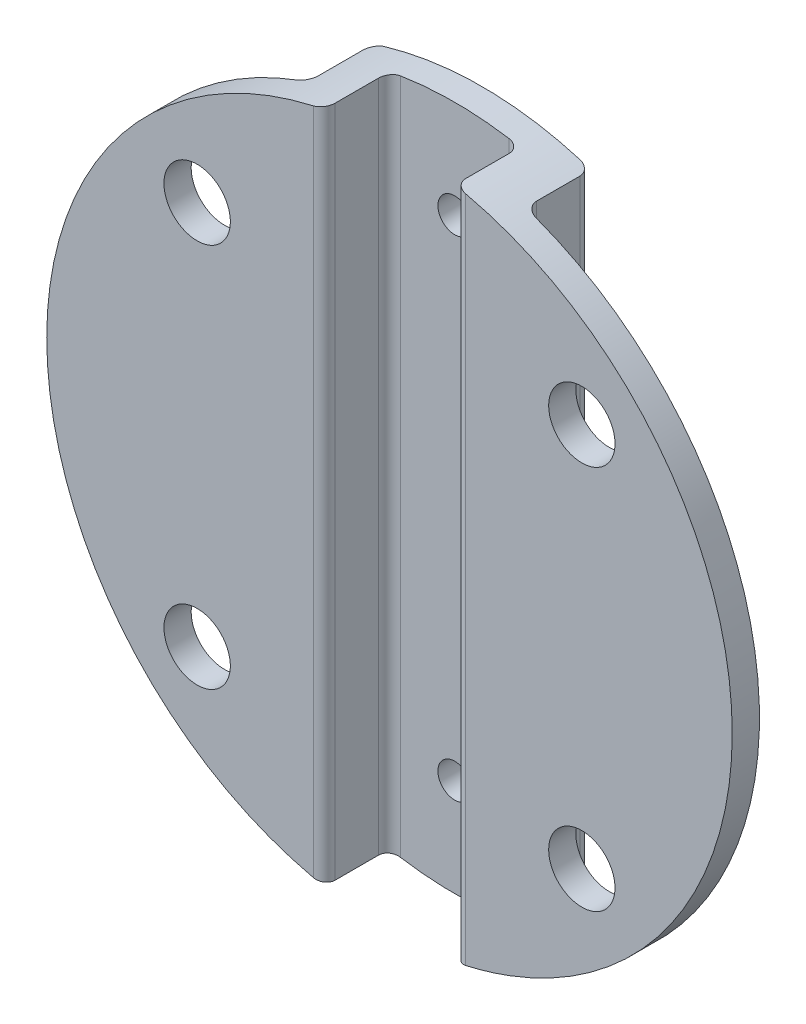
from build123d import *

# Parameters (mm, degrees)
EXTRUDE_1_DEPTH     = 64
SKETCH_2_W          = 73.114285432
SKETCH_2_H          = 69.176673978
SKETCH_2_R          = 31.5
CUT_EXTRUDE_2_DEPTH = 64
SKETCH_3_R          = 3.05
CUT_EXTRUDE_3_DEPTH = 64
SKETCH_4_R          = 1.55
CUT_EXTRUDE_4_DEPTH = 64


with BuildPart() as part:
    # 草图1 → 凸台-拉伸1 (new body)
    with BuildSketch(Plane(origin=(0, 0, 0), x_dir=(1, 0, 0), z_dir=(0, 1, 0))):
        with BuildLine():
            Line((-32, 0), (-7, 0))
            ThreePointArc((-7, 0), (-6.292893219, 0.292893219), (-6, 1))
            Line((-6, 1), (-6, 5))
            ThreePointArc((-6, 5), (-5.707106781, 5.707106781), (-5, 6))
            Line((-5, 6), (5, 6))
            ThreePointArc((5, 6), (5.707106781, 5.707106781), (6, 5))
            Line((6, 5), (6, 1))
            ThreePointArc((6, 1), (6.292893219, 0.292893219), (7, 0))
            Line((7, 0), (32, 0))
            Line((32, 0), (32, 2.5))
            Line((32, 2.5), (11, 2.5))
            ThreePointArc((11, 2.5), (10.292893219, 2.792893219), (10, 3.5))
            Line((10, 3.5), (10, 7.5))
            ThreePointArc((10, 7.5), (9.707106781, 8.207106781), (9, 8.5))
            Line((9, 8.5), (-9, 8.5))
            ThreePointArc((-9, 8.5), (-9.707106781, 8.207106781), (-10, 7.5))
            Line((-10, 7.5), (-10, 3.5))
            ThreePointArc((-10, 3.5), (-10.292893219, 2.792893219), (-11, 2.5))
            Line((-11, 2.5), (-32, 2.5))
            Line((-32, 2.5), (-32, 0))
        make_face()
    extrude(amount=EXTRUDE_1_DEPTH)

    # 草图2 → 切除-拉伸2 (cut)
    with BuildSketch(Plane.XY):
        with Locations((0, 32)):
            Rectangle(SKETCH_2_W, SKETCH_2_H)
        with Locations(Location((0, 32, 0), (0, 0, 290.438779576))):
            Circle(SKETCH_2_R, mode=Mode.SUBTRACT)
    extrude(amount=-CUT_EXTRUDE_2_DEPTH, mode=Mode.SUBTRACT)

    # 草图3 → 切除-拉伸3 (cut)
    with BuildSketch(Plane(origin=(0, 0, -2.5), x_dir=(-1, 0, 0), z_dir=(0, 0, -1))):
        with Locations((-17.67766953, 14.32233047)):
            Circle(SKETCH_3_R)
        with Locations((-17.67766953, 49.67766953)):
            Circle(SKETCH_3_R)
        with Locations((17.67766953, 49.67766953)):
            Circle(SKETCH_3_R)
        with Locations((17.67766953, 14.32233047)):
            Circle(SKETCH_3_R)
    extrude(amount=-CUT_EXTRUDE_3_DEPTH, mode=Mode.SUBTRACT)

    # 草图4 → 切除-拉伸4 (cut)
    with BuildSketch(Plane(origin=(0, 0, -8.5), x_dir=(-1, 0, 0), z_dir=(0, 0, -1))):
        with Locations((0, 54.5)):
            Circle(SKETCH_4_R)
        with Locations((0, 9.5)):
            Circle(SKETCH_4_R)
    extrude(amount=-CUT_EXTRUDE_4_DEPTH, mode=Mode.SUBTRACT)


solid = part.part
